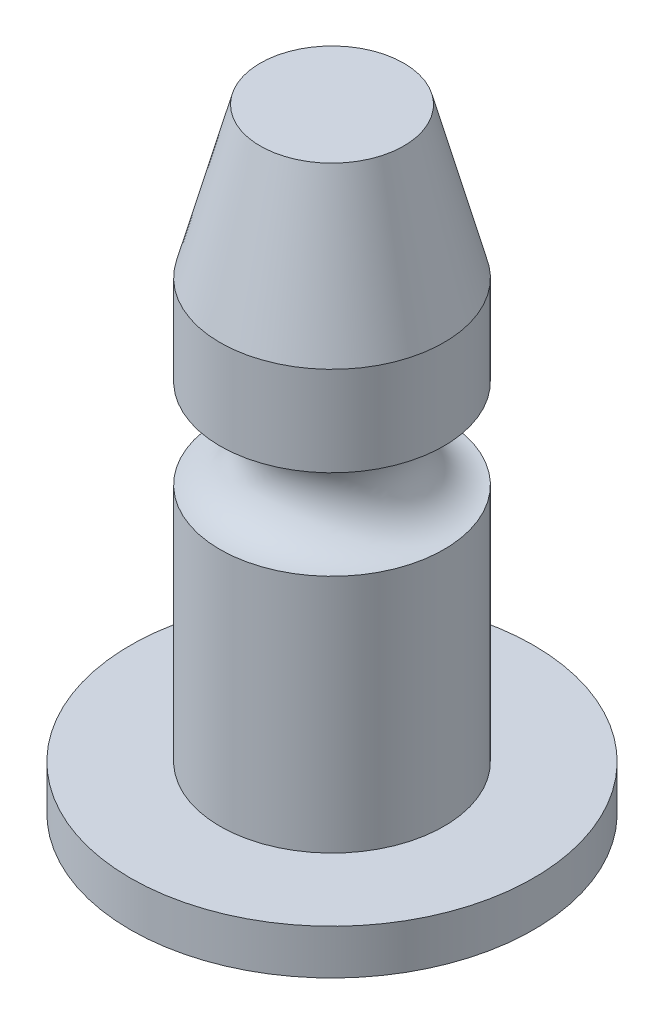
from build123d import *


with BuildPart() as part:
    # Sketch1 → Revolve1 (revolve)
    with BuildSketch(Plane.XY, mode=Mode.PRIVATE) as revolve1_sk:
        with BuildLine():
            Line((0, 6.35), (-1.602370205, 6.35))
            Line((-1.602370205, 6.35), (-2.5, 3))
            Line((-2.5, 3), (-2.5, 1))
            ThreePointArc((-2.5, 1), (-1.5, 0), (-2.5, -1))
            Line((-2.5, -1), (-2.5, -6.35))
            Line((-2.5, -6.35), (-4.5, -6.35))
            Line((-4.5, -6.35), (-4.5, -7.35))
            Line((-4.5, -7.35), (0, -7.35))
            Line((0, -7.35), (0, 6.35))
        make_face()
    revolve(revolve1_sk.sketch.rotate(Axis((0, 0, 0), (0, 1, 0)), 270), axis=Axis((0, 0, 0), (0, 1, 0)))


solid = part.part
